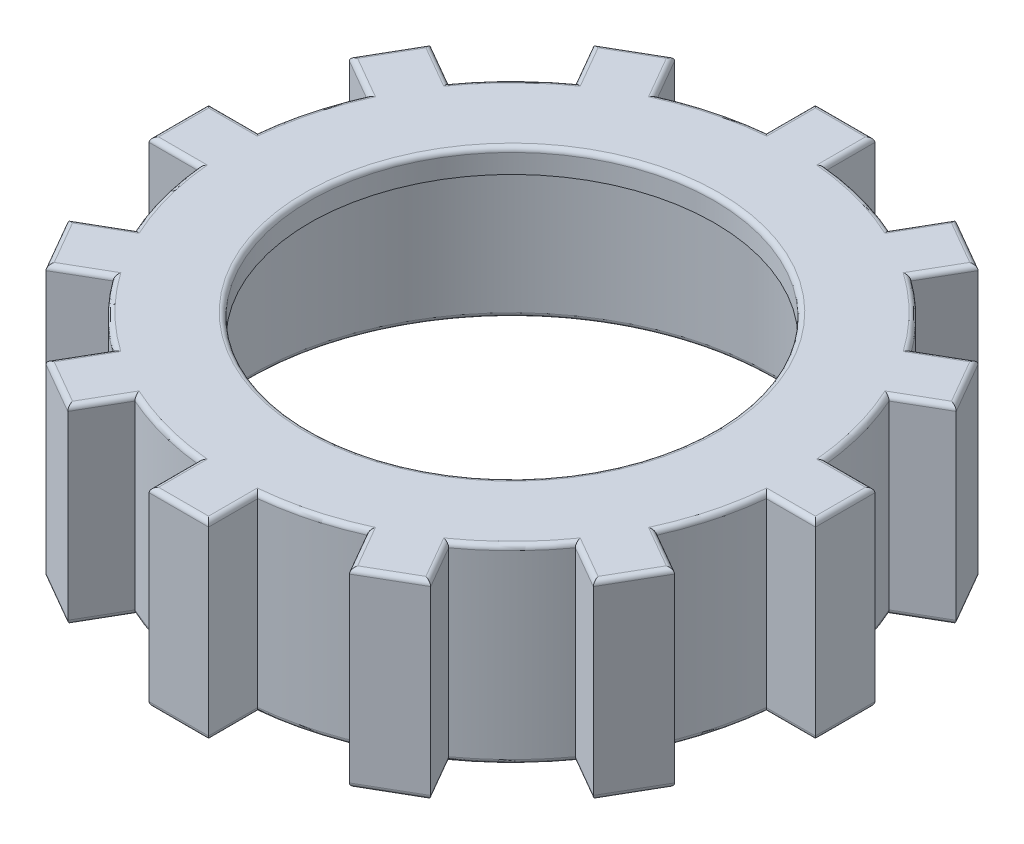
from build123d import *

# Parameters (mm, degrees)
EXTRUSION1_DEPTH             = 8
R_P_TITION_CIRCULAIRE1_COUNT = 12
CONG_1_R                     = 0.2


with BuildPart() as part:
    # Esquisse1 → Révolution1 (revolve)
    with BuildSketch(Plane.XY, mode=Mode.PRIVATE) as r_volution1_sk:
        Polygon((-8.5, 8), (-12, 8), (-12, 0), (-11, 0), (-11, 7), (-8.5, 7), align=None)
    revolve(r_volution1_sk.sketch.rotate(Axis((0, 0, 0), (0, 1, 0)), 270), axis=Axis((0, 0, 0), (0, 1, 0)))

    # Esquisse2 → Extrusion1 (add)
    with BuildSketch(Plane.XZ):
        with BuildLine():
            Line((-1.25, -11.934718262), (-1.25, -14))
            Line((-1.25, -14), (1.25, -14))
            Line((1.25, -14), (1.25, -11.934718262))
            ThreePointArc((1.25, -11.934718262), (0, -12), (-1.25, -11.934718262))
        make_face()
    extrusion1 = extrude(amount=-EXTRUSION1_DEPTH)

    # Répétition circulaire1: Extrusion1 ×12 about axis
    r_p_tition_circulaire1_axis = Axis((0, 0, 0), (0, 1, 0))
    for i in range(1, R_P_TITION_CIRCULAIRE1_COUNT):
        add(extrusion1.rotate(r_p_tition_circulaire1_axis, i * 360 / R_P_TITION_CIRCULAIRE1_COUNT))

    # Congé1
    cong_1_edges = [part.edges().sort_by_distance(p)[0] for p in [
        (0, 8, 8.5),
        (-3.105828541, 8, -11.591109915),
        (-1.25, 8, -12.967359131),
        (0, 8, -14),
        (1.25, 8, -12.967359131),
        (3.105828541, 8, -11.591109915),
        (5.401147811, 8, -11.855062428),
        (7, 8, -12.124355653),
        (7.56621132, 8, -10.605062428),
        (8.485281374, 8, -8.485281374),
        (10.605062428, 8, -7.56621132),
        (12.124355653, 8, -7),
        (11.855062428, 8, -5.401147811),
        (11.591109915, 8, -3.105828541),
        (12.967359131, 8, -1.25),
        (14, 8, 0),
        (12.967359131, 8, 1.25),
        (11.591109915, 8, 3.105828541),
        (11.855062428, 8, 5.401147811),
        (12.124355653, 8, 7),
        (10.605062428, 8, 7.56621132),
        (8.485281374, 8, 8.485281374),
        (7.56621132, 8, 10.605062428),
        (7, 8, 12.124355653),
        (5.401147811, 8, 11.855062428),
        (3.105828541, 8, 11.591109915),
        (1.25, 8, 12.967359131),
        (0, 8, 14),
        (-1.25, 8, 12.967359131),
        (-3.105828541, 8, 11.591109915),
        (-5.401147811, 8, 11.855062428),
        (-7, 8, 12.124355653),
        (-7.56621132, 8, 10.605062428),
        (-8.485281374, 8, 8.485281374),
        (-10.605062428, 8, 7.56621132),
        (-12.124355653, 8, 7),
        (-11.855062428, 8, 5.401147811),
        (-11.591109915, 8, 3.105828541),
        (-12.967359131, 8, 1.25),
        (-14, 8, 0),
        (-12.967359131, 8, -1.25),
        (-11.591109915, 8, -3.105828541),
        (-11.855062428, 8, -5.401147811),
        (-12.124355653, 8, -7),
        (-10.605062428, 8, -7.56621132),
        (-8.485281374, 8, -8.485281374),
        (-7.56621132, 8, -10.605062428),
        (-7, 8, -12.124355653),
        (-5.401147811, 8, -11.855062428),
        (-3.105828541, 0, -11.591109915),
        (-1.25, 0, -12.967359131),
        (0, 0, -14),
        (1.25, 0, -12.967359131),
        (8.485281374, 0, -8.485281374),
        (3.105828541, 0, -11.591109915),
        (10.605062428, 0, -7.56621132),
        (12.124355653, 0, -7),
        (11.855062428, 0, -5.401147811),
        (11.591109915, 0, -3.105828541),
        (12.967359131, 0, -1.25),
        (14, 0, 0),
        (12.967359131, 0, 1.25),
        (11.591109915, 0, 3.105828541),
        (11.855062428, 0, 5.401147811),
        (12.124355653, 0, 7),
        (10.605062428, 0, 7.56621132),
        (8.485281374, 0, 8.485281374),
        (7.56621132, 0, 10.605062428),
        (7, 0, 12.124355653),
        (5.401147811, 0, 11.855062428),
        (3.105828541, 0, 11.591109915),
        (1.25, 0, 12.967359131),
        (0, 0, 14),
        (-1.25, 0, 12.967359131),
        (-3.105828541, 0, 11.591109915),
        (-5.401147811, 0, 11.855062428),
        (-7, 0, 12.124355653),
        (-7.56621132, 0, 10.605062428),
        (-8.485281374, 0, 8.485281374),
        (-10.605062428, 0, 7.56621132),
        (-12.124355653, 0, 7),
        (-11.855062428, 0, 5.401147811),
        (-11.591109915, 0, 3.105828541),
        (-12.967359131, 0, 1.25),
        (-14, 0, 0),
        (-12.967359131, 0, -1.25),
        (-11.591109915, 0, -3.105828541),
        (-11.855062428, 0, -5.401147811),
        (-12.124355653, 0, -7),
        (-10.605062428, 0, -7.56621132),
        (-8.485281374, 0, -8.485281374),
        (-7.56621132, 0, -10.605062428),
        (-7, 0, -12.124355653),
        (-5.401147811, 0, -11.855062428),
        (7.56621132, 0, -10.605062428),
        (7, 0, -12.124355653),
        (5.401147811, 0, -11.855062428),
        (0, 0, 11),
    ]]
    fillet(cong_1_edges, radius=CONG_1_R)


solid = part.part
